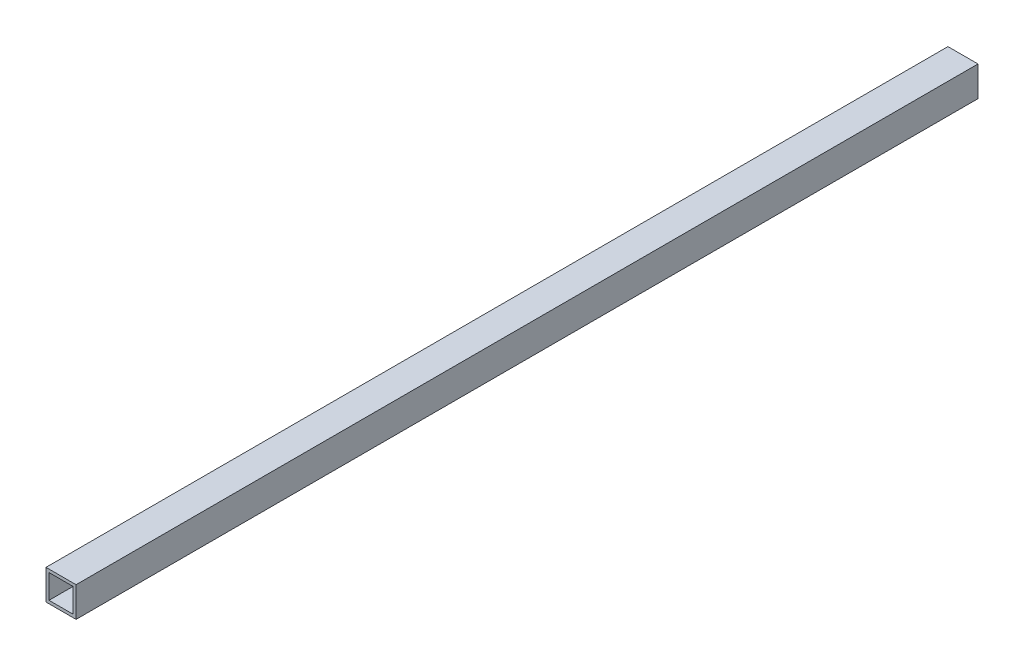
from build123d import *

# Parameters (mm, degrees)
SKETCH_1_W      = 20
SKETCH_1_H      = 20
SKETCH_1_W_2    = 16
SKETCH_1_H_2    = 16
EXTRUDE_1_DEPTH = 600


with BuildPart() as part:
    # 草图1 → 凸台-拉伸1 (new body)
    with BuildSketch(Plane.XY):
        Rectangle(SKETCH_1_W, SKETCH_1_H)
        Rectangle(SKETCH_1_W_2, SKETCH_1_H_2, mode=Mode.SUBTRACT)
    extrude(amount=EXTRUDE_1_DEPTH)


solid = part.part
